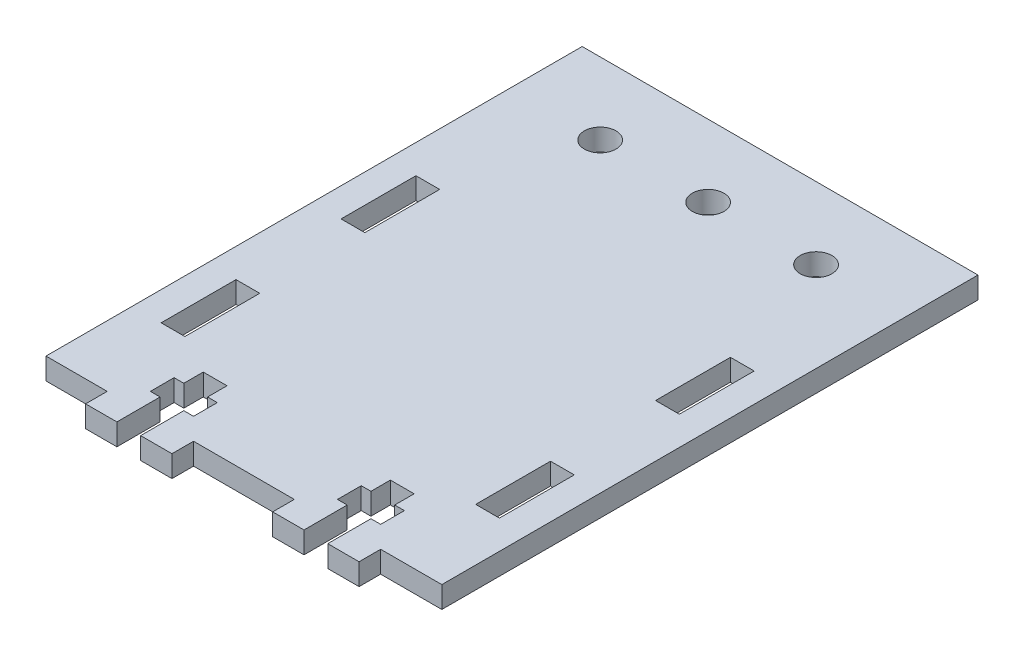
from build123d import *

# Parameters (mm, degrees)
SKETCH_1_W             = 55
SKETCH_1_H             = 74.5
SKETCH_1_R             = 2.2
SKETCH_1_W_2           = 12
SKETCH_1_H_2           = 3
EXTRUDE_1_DEPTH        = 3
SKETCH_2_W             = 3.3
SKETCH_2_H             = 10.4
CUT_EXTRUDE_1_DEPTH    = 3
SKETCH_3_W             = 1.35
SKETCH_3_H             = 3.3
SKETCH_3_W_2           = 3.3
SKETCH_3_H_2           = 2.7
SKETCH_3_H_3           = 6
CUT_EXTRUDE_2_DEPTH    = 3
PATTERN_LINEAR_1_COUNT = 2
PATTERN_LINEAR_1_PITCH = 25


with BuildPart() as part:
    # 草图1 → 凸台-拉伸1 (new body)
    # profile 1 of 3: a face of its own
    with BuildSketch(Plane(origin=(0, 0, 0), x_dir=(1, 0, 0), z_dir=(0, 1, 0))):
        Rectangle(SKETCH_1_W, SKETCH_1_H)
        with Locations(Location((0, 27.25, 0), (0, 0, 270))):
            Circle(SKETCH_1_R, mode=Mode.SUBTRACT)
        with Locations(Location((-15, 27.25, 0), (0, 0, 270))):
            Circle(SKETCH_1_R, mode=Mode.SUBTRACT)
        with Locations(Location((15, 27.25, 0), (0, 0, 270))):
            Circle(SKETCH_1_R, mode=Mode.SUBTRACT)
    # profile 2 of 3: a face of its own
    with BuildSketch(Plane(origin=(0, 0, 0), x_dir=(1, 0, 0), z_dir=(0, 1, 0))):
        with Locations((-13, -38.75)):
            Rectangle(SKETCH_1_W_2, SKETCH_1_H_2)
    # profile 3 of 3: a face of its own
    with BuildSketch(Plane(origin=(0, 0, 0), x_dir=(1, 0, 0), z_dir=(0, 1, 0))):
        with Locations((13, -38.75)):
            Rectangle(SKETCH_1_W_2, SKETCH_1_H_2)
    extrude(amount=EXTRUDE_1_DEPTH)

    # 草图2 → 切除-拉伸1 (cut)
    with BuildSketch(Plane(origin=(0, 3, 0), x_dir=(1, 0, 0), z_dir=(0, 1, 0))):
        with Locations((-21.85, -20.05)):
            Rectangle(SKETCH_2_W, SKETCH_2_H)
        with Locations((21.85, -20.05)):
            Rectangle(SKETCH_2_W, SKETCH_2_H)
    cut_extrude_1 = extrude(amount=-CUT_EXTRUDE_1_DEPTH, mode=Mode.SUBTRACT)

    # 草图3 → 切除-拉伸2 (cut)
    with BuildSketch(Plane(origin=(0, 3, 0), x_dir=(1, 0, 0), z_dir=(0, 1, 0))):
        with Locations((-10.675, -32.6)):
            Rectangle(SKETCH_3_W, SKETCH_3_H)
        with Locations((-13, -29.6)):
            Rectangle(SKETCH_3_W_2, SKETCH_3_H_2)
        with Locations((-13, -32.6)):
            Rectangle(SKETCH_3_W_2, SKETCH_3_H)
        with Locations((-13, -37.25)):
            Rectangle(SKETCH_3_W_2, SKETCH_3_H_3)
        with Locations((-15.325, -32.6)):
            Rectangle(SKETCH_3_W, SKETCH_3_H)
        with Locations((13, -37.25)):
            Rectangle(SKETCH_3_W_2, SKETCH_3_H_3)
        with Locations((15.325, -32.6)):
            Rectangle(SKETCH_3_W, SKETCH_3_H)
        with Locations((13, -32.6)):
            Rectangle(SKETCH_3_W_2, SKETCH_3_H)
        with Locations((13, -29.6)):
            Rectangle(SKETCH_3_W_2, SKETCH_3_H_2)
        with Locations((10.675, -32.6)):
            Rectangle(SKETCH_3_W, SKETCH_3_H)
    extrude(amount=-CUT_EXTRUDE_2_DEPTH, mode=Mode.SUBTRACT)

    # 阵列(线性)1: 切除-拉伸1 ×2
    with Locations(*[(0, 0, -i * PATTERN_LINEAR_1_PITCH) for i in range(1, PATTERN_LINEAR_1_COUNT)]):
        add(cut_extrude_1, mode=Mode.SUBTRACT)


solid = part.part
